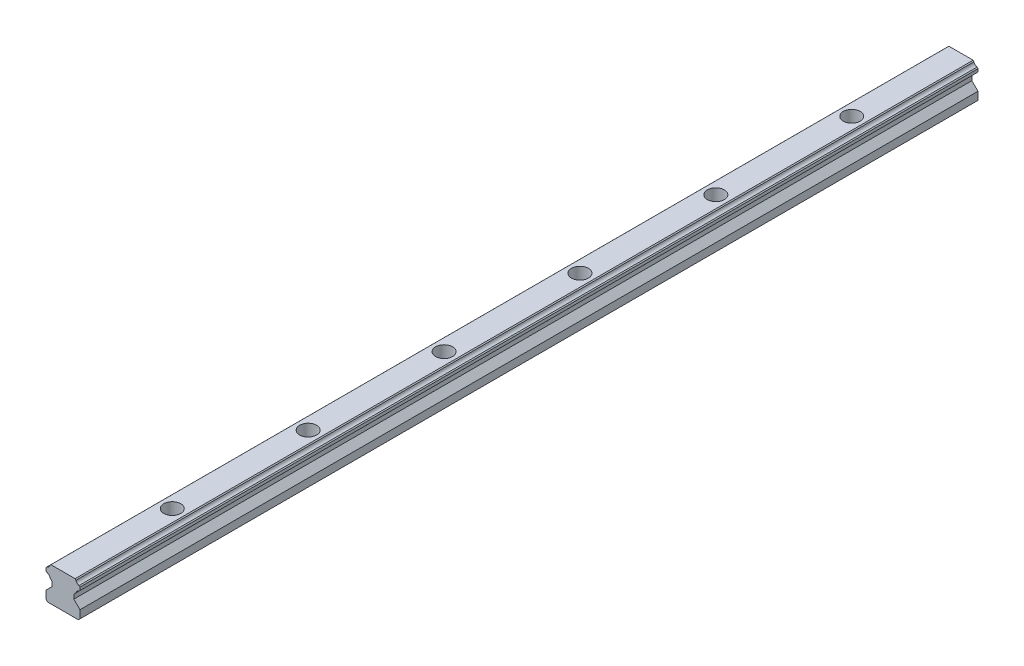
from build123d import *

# Parameters (mm, degrees)
EXTRUDE1_DEPTH     = 460
LPATTERN1_COUNT    = 8
LPATTERN1_PITCH    = 60
SKETCH3_W          = 35.37212132
SKETCH3_H          = 31.75
SKETCH3_R          = 2.25
SKETCH3_W_2        = 31.665058017
SKETCH3_H_2        = 47.763491712
CUT_EXTRUDE1_DEPTH = 461.305605006


with BuildPart() as part:
    # Sketch1 → Extrude1 (new body)
    with BuildSketch(Plane(origin=(-20, 0, 0), x_dir=(1, 0, 0), z_dir=(0, 0, 1))):
        with BuildLine():
            Line((12.5, 0.69999271), (13.199992786, 0))
            Line((13.199992786, 0), (26.800007214, 0))
            Line((26.800007214, 0), (27.5, 0.69999271))
            Line((27.5, 0.69999271), (27.5, 4.2000246))
            Line((27.5, 4.2000246), (24.8000183, 6.9000063))
            Line((24.8000183, 6.9000063), (24.8000183, 8.8400054))
            Line((24.8000183, 8.8400054), (25.755946813, 9.794179118))
            ThreePointArc((25.755946813, 9.794179118), (26.198484624, 10.690600567), (27.09432569, 11.13431209))
            Line((27.09432569, 11.13431209), (27.5, 11.5399866))
            Line((27.5, 11.5399866), (27.5, 12.8500204))
            Line((27.5, 12.8500204), (27.09432569, 13.268442751))
            ThreePointArc((27.09432569, 13.268442751), (26.202460867, 13.706434947), (25.755946813, 14.594063938))
            Line((25.755946813, 14.594063938), (25.3500197, 15))
            Line((25.3500197, 15), (14.6499803, 15))
            Line((14.6499803, 15), (14.244053187, 14.594063938))
            ThreePointArc((14.244053187, 14.594063938), (13.797539133, 13.706434947), (12.90567431, 13.268442751))
            Line((12.90567431, 13.268442751), (12.5, 12.8500204))
            Line((12.5, 12.8500204), (12.5, 11.5399866))
            Line((12.5, 11.5399866), (12.90567431, 11.13431209))
            ThreePointArc((12.90567431, 11.13431209), (13.801515376, 10.690600567), (14.244053187, 9.794179118))
            Line((14.244053187, 9.794179118), (15.1999817, 8.8400054))
            Line((15.1999817, 8.8400054), (15.1999817, 6.9000063))
            Line((15.1999817, 6.9000063), (12.5, 4.2000246))
            Line((12.5, 4.2000246), (12.5, 0.69999271))
        make_face()
    extrude(amount=-EXTRUDE1_DEPTH)

    # Sketch2 → Cut-Revolve1 (revolve, cut)
    with BuildSketch(Plane(origin=(0, 0, 0), x_dir=(0, 0, -1), z_dir=(1, 0, 0))):
        Polygon((20, 15), (23.75, 15), (23.75, 9.7), (22.25, 9.7), (22.25, 0), (20, 0), align=None)
    cut_revolve1 = revolve(axis=Axis((0, 0, -20), (0, 1, 0)), mode=Mode.SUBTRACT)

    # LPattern1: Cut-Revolve1 ×8
    with Locations(*[(0, 0, -i * LPATTERN1_PITCH) for i in range(1, LPATTERN1_COUNT)]):
        add(cut_revolve1, mode=Mode.SUBTRACT)

    # Sketch3 → Cut-Extrude1 (cut, through all)
    # profile 1 of 2: a face of its own
    with BuildSketch(Plane.XZ):
        with Locations((-3.184714061, -15.875)):
            Rectangle(SKETCH3_W, SKETCH3_H)
        with Locations((0, -20)):
            Circle(SKETCH3_R, mode=Mode.SUBTRACT)
    # profile 2 of 2: a face of its own
    with BuildSketch(Plane.XZ):
        with Locations((-1.33118241, -452.125745856)):
            Rectangle(SKETCH3_W_2, SKETCH3_H_2)
        with Locations((0, -440)):
            Circle(SKETCH3_R, mode=Mode.SUBTRACT)
    extrude(amount=-CUT_EXTRUDE1_DEPTH, mode=Mode.SUBTRACT)


solid = part.part
